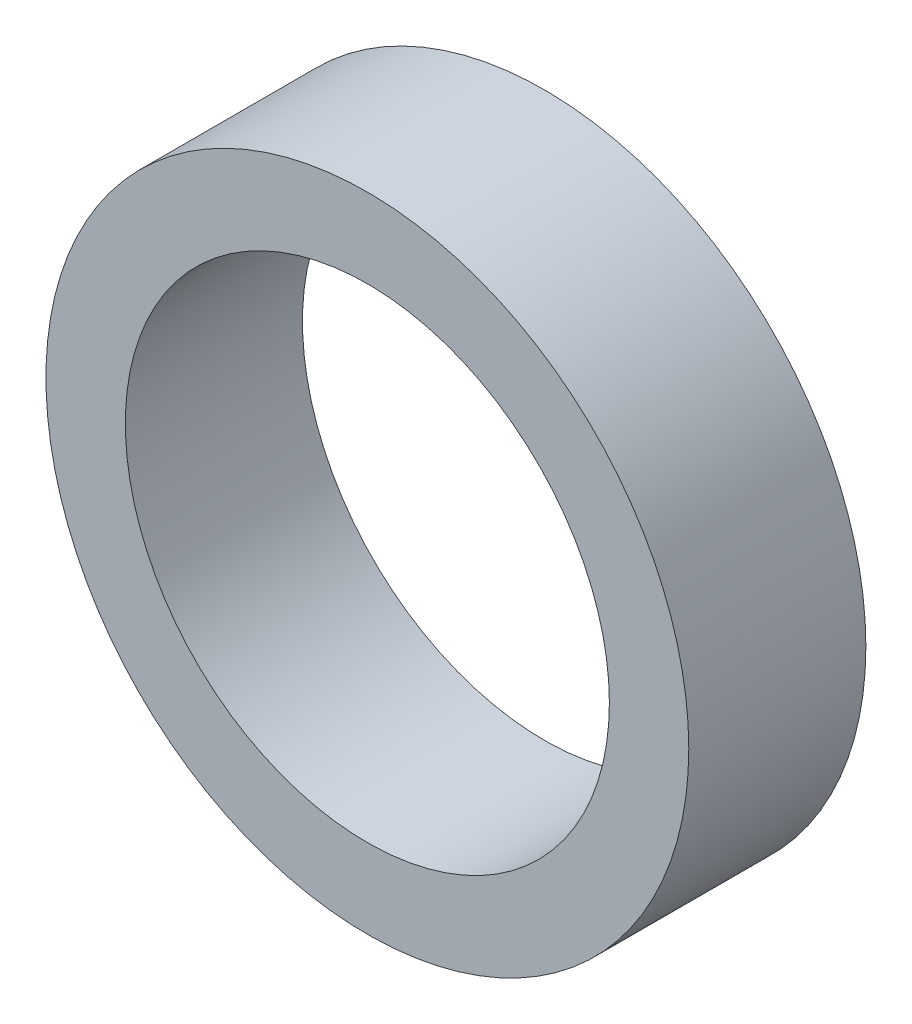
from build123d import *

# Parameters (mm, degrees)
SKIZZE1_R                       = 5.445
SKIZZE1_R_2                     = 4.1
AUFSATZ_LINEAR_AUSTRAGEN1_DEPTH = 3


with BuildPart() as part:
    # Skizze1 → Aufsatz-Linear austragen1 (new body)
    with BuildSketch(Plane.XY):
        Circle(SKIZZE1_R)
        Circle(SKIZZE1_R_2, mode=Mode.SUBTRACT)
    extrude(amount=AUFSATZ_LINEAR_AUSTRAGEN1_DEPTH)


solid = part.part
